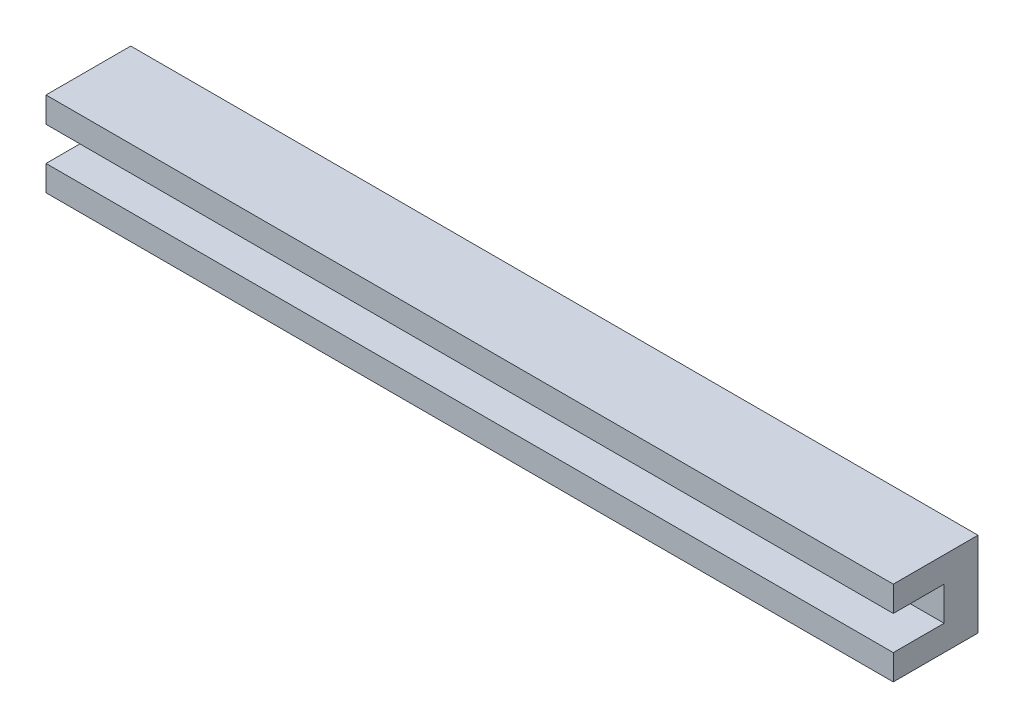
from build123d import *

# Parameters (mm, degrees)
SKETCH_1_W      = 100
SKETCH_1_H      = 10
EXTRUDE_1_DEPTH = 4
SKETCH_2_W      = 100
SKETCH_2_H      = 3
EXTRUDE_2_DEPTH = 6


with BuildPart() as part:
    # 草图1 → 凸台-拉伸1 (new body)
    with BuildSketch(Plane.XY):
        with Locations((1.023241914, 15.99731763)):
            Rectangle(SKETCH_1_W, SKETCH_1_H)
    extrude(amount=EXTRUDE_1_DEPTH)

    # 草图2 → 凸台-拉伸2 (add)
    with BuildSketch(Plane.XY.offset(4)):
        with Locations((1.023241914, 19.49731763)):
            Rectangle(SKETCH_2_W, SKETCH_2_H)
        with Locations((1.023241914, 12.49731763)):
            Rectangle(SKETCH_2_W, SKETCH_2_H)
    extrude(amount=EXTRUDE_2_DEPTH)


solid = part.part
